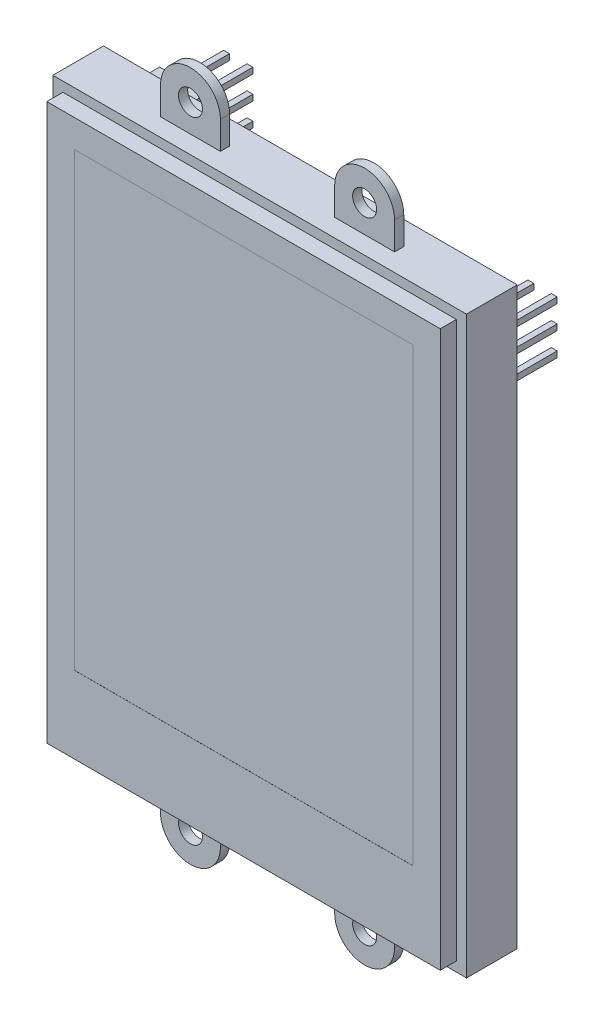
from build123d import *

# Parameters (mm, degrees)
ESQUISSE1_W                 = 44.9
ESQUISSE1_H                 = 62.4
BASE_PLASTIQUE_DEPTH        = 5.5
ESQUISSE2_W                 = 42.7
ESQUISSE2_H                 = 60.3
CORP_ECRAN_DEPTH            = 1.75
ESQUISSE3_W                 = 36.72
ESQUISSE3_H                 = 48.96
ECRAN_DEPTH                 = 0.01
OREILLES_START              = 2.56
ESQUISSE4_R                 = 1.3
OREILLES_DEPTH              = 1
ESQUISSE5_W                 = 0.64
ESQUISSE5_H                 = 0.64
PINS_DEPTH                  = 8.9
ESQUISSE6_W                 = 5.08
ESQUISSE6_H                 = 38.1
ESQUISSE6_H_2               = 7.62
ESQUISSE6_H_3               = 12.7
PLASTIQUE_CONNECTEURS_DEPTH = 2.9


with BuildPart() as part:
    # Esquisse1 → base plastique (new body)
    with BuildSketch(Plane.XY.offset(5.44)):
        Rectangle(ESQUISSE1_W, ESQUISSE1_H)
    extrude(amount=BASE_PLASTIQUE_DEPTH)

    # Esquisse2 → corp ecran (add)
    with BuildSketch(Plane.XY.offset(10.94)):
        Rectangle(ESQUISSE2_W, ESQUISSE2_H)
    extrude(amount=CORP_ECRAN_DEPTH)

    # Esquisse3 → ecran (cut)
    with BuildSketch(Plane.XY.offset(12.69)):
        with Locations((0.01, 2.67)):
            Rectangle(ESQUISSE3_W, ESQUISSE3_H)
    extrude(amount=-ECRAN_DEPTH, mode=Mode.SUBTRACT)

    # Esquisse4 → oreilles (add)
    # profile 1 of 4: a face of its own
    with BuildSketch(Plane.XY.offset(5.44).offset(OREILLES_START)):
        with BuildLine():
            Line((6.2, 34.2), (6.2, 31.2))
            Line((6.2, 31.2), (12.7, 31.2))
            Line((12.7, 31.2), (12.7, 34.2))
            ThreePointArc((12.7, 34.2), (9.45, 37.45), (6.2, 34.2))
        make_face()
        with Locations((9.45, 34.2)):
            Circle(ESQUISSE4_R, mode=Mode.SUBTRACT)
    # profile 2 of 4: a face of its own
    with BuildSketch(Plane.XY.offset(5.44).offset(OREILLES_START)):
        with BuildLine():
            Line((-12.7, 31.2), (-12.7, 34.2))
            ThreePointArc((-12.7, 34.2), (-9.45, 37.45), (-6.2, 34.2))
            Line((-6.2, 34.2), (-6.2, 31.2))
            Line((-6.2, 31.2), (-12.7, 31.2))
        make_face()
        with Locations(Location((-9.45, 34.2, 0), (0, 0, 180))):
            Circle(ESQUISSE4_R, mode=Mode.SUBTRACT)
    # profile 3 of 4: a face of its own
    with BuildSketch(Plane.XY.offset(5.44).offset(OREILLES_START)):
        with BuildLine():
            Line((6.2, -34.2), (6.2, -31.2))
            Line((6.2, -31.2), (12.7, -31.2))
            Line((12.7, -31.2), (12.7, -34.2))
            ThreePointArc((12.7, -34.2), (9.45, -37.45), (6.2, -34.2))
        make_face()
        with Locations(Location((9.45, -34.2, 0), (0, 0, 180))):
            Circle(ESQUISSE4_R, mode=Mode.SUBTRACT)
    # profile 4 of 4: a face of its own
    with BuildSketch(Plane.XY.offset(5.44).offset(OREILLES_START)):
        with BuildLine():
            Line((-12.7, -31.2), (-12.7, -34.2))
            ThreePointArc((-12.7, -34.2), (-9.45, -37.45), (-6.2, -34.2))
            Line((-6.2, -34.2), (-6.2, -31.2))
            Line((-6.2, -31.2), (-12.7, -31.2))
        make_face()
        with Locations((-9.45, -34.2)):
            Circle(ESQUISSE4_R, mode=Mode.SUBTRACT)
    extrude(amount=OREILLES_DEPTH)

    # Esquisse5 → pins (add)
    with BuildSketch(Plane(origin=(0, 0, 5.44), x_dir=(-1, 0, 0), z_dir=(0, 0, -1))):
        with Locations((15.45, 28.1)):
            Rectangle(ESQUISSE5_W, ESQUISSE5_H)
        with Locations((17.99, 28.1)):
            Rectangle(ESQUISSE5_W, ESQUISSE5_H)
        with Locations((15.45, 25.56)):
            Rectangle(ESQUISSE5_W, ESQUISSE5_H)
        with Locations((17.99, 25.56)):
            Rectangle(ESQUISSE5_W, ESQUISSE5_H)
        with Locations((15.45, 23.02)):
            Rectangle(ESQUISSE5_W, ESQUISSE5_H)
        with Locations((17.99, 23.02)):
            Rectangle(ESQUISSE5_W, ESQUISSE5_H)
        with Locations((15.45, 20.48)):
            Rectangle(ESQUISSE5_W, ESQUISSE5_H)
        with Locations((17.99, 20.48)):
            Rectangle(ESQUISSE5_W, ESQUISSE5_H)
        with Locations((15.45, 17.94)):
            Rectangle(ESQUISSE5_W, ESQUISSE5_H)
        with Locations((17.99, 17.94)):
            Rectangle(ESQUISSE5_W, ESQUISSE5_H)
        with Locations((15.45, 15.4)):
            Rectangle(ESQUISSE5_W, ESQUISSE5_H)
        with Locations((17.99, 15.4)):
            Rectangle(ESQUISSE5_W, ESQUISSE5_H)
        with Locations((15.45, 12.86)):
            Rectangle(ESQUISSE5_W, ESQUISSE5_H)
        with Locations((17.99, 12.86)):
            Rectangle(ESQUISSE5_W, ESQUISSE5_H)
        with Locations((15.45, 10.32)):
            Rectangle(ESQUISSE5_W, ESQUISSE5_H)
        with Locations((17.99, 10.32)):
            Rectangle(ESQUISSE5_W, ESQUISSE5_H)
        with Locations((15.45, 7.78)):
            Rectangle(ESQUISSE5_W, ESQUISSE5_H)
        with Locations((17.99, 7.78)):
            Rectangle(ESQUISSE5_W, ESQUISSE5_H)
        with Locations((15.45, 5.24)):
            Rectangle(ESQUISSE5_W, ESQUISSE5_H)
        with Locations((17.99, 5.24)):
            Rectangle(ESQUISSE5_W, ESQUISSE5_H)
        with Locations((15.45, 2.7)):
            Rectangle(ESQUISSE5_W, ESQUISSE5_H)
        with Locations((17.99, 2.7)):
            Rectangle(ESQUISSE5_W, ESQUISSE5_H)
        with Locations((15.45, 0.16)):
            Rectangle(ESQUISSE5_W, ESQUISSE5_H)
        with Locations((17.99, 0.16)):
            Rectangle(ESQUISSE5_W, ESQUISSE5_H)
        with Locations((15.45, -2.38)):
            Rectangle(ESQUISSE5_W, ESQUISSE5_H)
        with Locations((17.99, -2.38)):
            Rectangle(ESQUISSE5_W, ESQUISSE5_H)
        with Locations((15.45, -4.92)):
            Rectangle(ESQUISSE5_W, ESQUISSE5_H)
        with Locations((17.99, -4.92)):
            Rectangle(ESQUISSE5_W, ESQUISSE5_H)
        with Locations((15.45, -7.46)):
            Rectangle(ESQUISSE5_W, ESQUISSE5_H)
        with Locations((17.99, -7.46)):
            Rectangle(ESQUISSE5_W, ESQUISSE5_H)
        with Locations((15.45, -12.54)):
            Rectangle(ESQUISSE5_W, ESQUISSE5_H)
        with Locations((17.99, -12.54)):
            Rectangle(ESQUISSE5_W, ESQUISSE5_H)
        with Locations((15.45, -15.08)):
            Rectangle(ESQUISSE5_W, ESQUISSE5_H)
        with Locations((17.99, -15.08)):
            Rectangle(ESQUISSE5_W, ESQUISSE5_H)
        with Locations((15.45, -17.62)):
            Rectangle(ESQUISSE5_W, ESQUISSE5_H)
        with Locations((17.99, -17.62)):
            Rectangle(ESQUISSE5_W, ESQUISSE5_H)
        with Locations((15.45, -20.16)):
            Rectangle(ESQUISSE5_W, ESQUISSE5_H)
        with Locations((17.99, -20.16)):
            Rectangle(ESQUISSE5_W, ESQUISSE5_H)
        with Locations((15.45, -22.7)):
            Rectangle(ESQUISSE5_W, ESQUISSE5_H)
        with Locations((17.99, -22.7)):
            Rectangle(ESQUISSE5_W, ESQUISSE5_H)
        with Locations((-17.57, 17.94)):
            Rectangle(ESQUISSE5_W, ESQUISSE5_H)
        with Locations((-15.03, 17.94)):
            Rectangle(ESQUISSE5_W, ESQUISSE5_H)
        with Locations((-17.57, 20.48)):
            Rectangle(ESQUISSE5_W, ESQUISSE5_H)
        with Locations((-15.03, 20.48)):
            Rectangle(ESQUISSE5_W, ESQUISSE5_H)
        with Locations((-17.57, 23.02)):
            Rectangle(ESQUISSE5_W, ESQUISSE5_H)
        with Locations((-15.03, 23.02)):
            Rectangle(ESQUISSE5_W, ESQUISSE5_H)
    extrude(amount=PINS_DEPTH)

    # Esquisse6 → plastique connecteurs (add)
    with BuildSketch(Plane(origin=(0, 0, 5.44), x_dir=(-1, 0, 0), z_dir=(0, 0, -1))):
        with Locations((16.72, 10.32)):
            Rectangle(ESQUISSE6_W, ESQUISSE6_H)
        with Locations((-16.3, 20.48)):
            Rectangle(ESQUISSE6_W, ESQUISSE6_H_2)
        with Locations((16.72, -17.62)):
            Rectangle(ESQUISSE6_W, ESQUISSE6_H_3)
    extrude(amount=PLASTIQUE_CONNECTEURS_DEPTH)


solid = part.part
